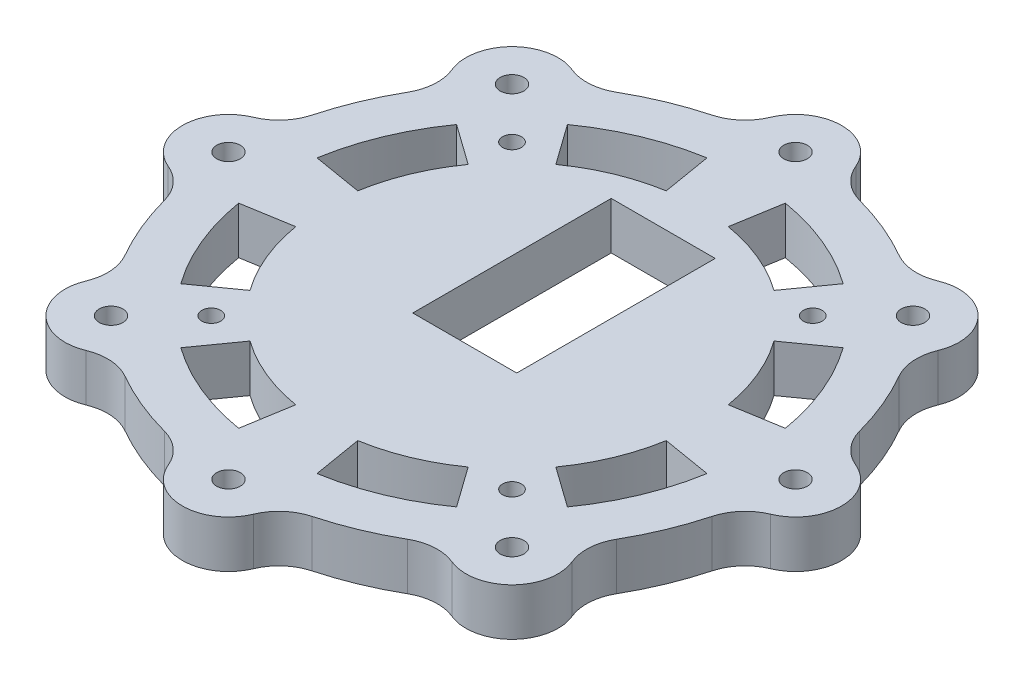
from build123d import *

# Parameters (mm, degrees)
CROQUIS1_W              = 22
CROQUIS1_H              = 42
CROQUIS1_R              = 2.5
CROQUIS1_R_2            = 2
SALIENTE_EXTRUIR1_DEPTH = 10
REDONDEO1_R             = 10
CROQUIS2_R              = 5
CORTAR_EXTRUIR1_DEPTH   = 5


with BuildPart() as part:
    # Croquis1 → Saliente-Extruir1 (new body)
    with BuildSketch(Plane(origin=(0, 0, 0), x_dir=(1, 0, 0), z_dir=(0, 1, 0))):
        with BuildLine():
            ThreePointArc((-34.99474883, -48.737742606), (-22.961005942, -55.432771951), (-9.717764093, -59.2078125))
            ThreePointArc((-9.717764093, -59.2078125), (0, -69.75), (9.717764093, -59.2078125))
            ThreePointArc((9.717764093, -59.2078125), (22.961005942, -55.432771951), (34.99474883, -48.737742606))
            ThreePointArc((34.99474883, -48.737742606), (49.320697988, -49.320697988), (48.737742606, -34.99474883))
            ThreePointArc((48.737742606, -34.99474883), (55.432771951, -22.961005942), (59.2078125, -9.717764093))
            ThreePointArc((59.2078125, -9.717764093), (69.75, 0), (59.2078125, 9.717764093))
            ThreePointArc((59.2078125, 9.717764093), (55.432771951, 22.961005942), (48.737742606, 34.99474883))
            ThreePointArc((48.737742606, 34.99474883), (49.320697988, 49.320697988), (34.99474883, 48.737742606))
            ThreePointArc((34.99474883, 48.737742606), (22.961005942, 55.432771951), (9.717764093, 59.2078125))
            ThreePointArc((9.717764093, 59.2078125), (0, 69.75), (-9.717764093, 59.2078125))
            ThreePointArc((-9.717764093, 59.2078125), (-22.961005942, 55.432771951), (-34.99474883, 48.737742606))
            ThreePointArc((-34.99474883, 48.737742606), (-49.320697988, 49.320697988), (-48.737742606, 34.99474883))
            ThreePointArc((-48.737742606, 34.99474883), (-55.432771951, 22.961005942), (-59.2078125, 9.717764093))
            ThreePointArc((-59.2078125, 9.717764093), (-69.75, 0), (-59.2078125, -9.717764093))
            ThreePointArc((-59.2078125, -9.717764093), (-55.432771951, -22.961005942), (-48.737742606, -34.99474883))
            ThreePointArc((-48.737742606, -34.99474883), (-49.320697988, -49.320697988), (-34.99474883, -48.737742606))
        make_face()
        with Locations((0, 11)):
            Rectangle(CROQUIS1_W, CROQUIS1_H, mode=Mode.SUBTRACT)
        with BuildLine():
            Line((6.560642333, 39.204852661), (8.293642194, 49.560851477))
            ThreePointArc((8.293642194, 49.560851477), (19.229842476, 46.424946509), (29.180323524, 40.909304797))
            Line((29.180323524, 40.909304797), (23.08294249, 32.361091855))
            ThreePointArc((23.08294249, 32.361091855), (15.211666437, 36.724211417), (6.560642333, 39.204852661))
        make_face(mode=Mode.SUBTRACT)
        with BuildLine():
            Line((-8.293642194, 49.560851477), (-6.560642333, 39.204852661))
            ThreePointArc((-6.560642333, 39.204852661), (-15.211666437, 36.724211417), (-23.08294249, 32.361091855))
            Line((-23.08294249, 32.361091855), (-29.180323524, 40.909304797))
            ThreePointArc((-29.180323524, 40.909304797), (-19.229842476, 46.424946509), (-8.293642194, 49.560851477))
        make_face(mode=Mode.SUBTRACT)
        with BuildLine():
            Line((-40.909304797, 29.180323524), (-32.361091855, 23.08294249))
            ThreePointArc((-32.361091855, 23.08294249), (-36.724211417, 15.211666437), (-39.204852661, 6.560642333))
            Line((-39.204852661, 6.560642333), (-49.560851477, 8.293642194))
            ThreePointArc((-49.560851477, 8.293642194), (-46.424946509, 19.229842476), (-40.909304797, 29.180323524))
        make_face(mode=Mode.SUBTRACT)
        with Locations(Location((-42.426406871, -42.426406871, 0), (0, 0, 270))):
            Circle(CROQUIS1_R, mode=Mode.SUBTRACT)
        with Locations(Location((-42.426406871, 42.426406871, 0), (0, 0, 270))):
            Circle(CROQUIS1_R, mode=Mode.SUBTRACT)
        with Locations(Location((-60, 0, 0), (0, 0, 270))):
            Circle(CROQUIS1_R, mode=Mode.SUBTRACT)
        with Locations(Location((0, -60, 0), (0, 0, 270))):
            Circle(CROQUIS1_R, mode=Mode.SUBTRACT)
        with Locations(Location((42.426406871, -42.426406871, 0), (0, 0, 270))):
            Circle(CROQUIS1_R, mode=Mode.SUBTRACT)
        with Locations(Location((60, 0, 0), (0, 0, 270))):
            Circle(CROQUIS1_R, mode=Mode.SUBTRACT)
        with Locations(Location((42.426406871, 42.426406871, 0), (0, 0, 270))):
            Circle(CROQUIS1_R, mode=Mode.SUBTRACT)
        with Locations(Location((0, 60, 0), (0, 0, 270))):
            Circle(CROQUIS1_R, mode=Mode.SUBTRACT)
        with BuildLine():
            Line((-49.560851477, -8.293642194), (-39.204852661, -6.560642333))
            ThreePointArc((-39.204852661, -6.560642333), (-36.724211417, -15.211666437), (-32.361091855, -23.08294249))
            Line((-32.361091855, -23.08294249), (-40.909304797, -29.180323524))
            ThreePointArc((-40.909304797, -29.180323524), (-46.424946509, -19.229842476), (-49.560851477, -8.293642194))
        make_face(mode=Mode.SUBTRACT)
        with BuildLine():
            Line((-29.180323524, -40.909304797), (-23.08294249, -32.361091855))
            ThreePointArc((-23.08294249, -32.361091855), (-15.211666437, -36.724211417), (-6.560642333, -39.204852661))
            Line((-6.560642333, -39.204852661), (-8.293642194, -49.560851477))
            ThreePointArc((-8.293642194, -49.560851477), (-19.229842476, -46.424946509), (-29.180323524, -40.909304797))
        make_face(mode=Mode.SUBTRACT)
        with BuildLine():
            Line((8.293642194, -49.560851477), (6.560642333, -39.204852661))
            ThreePointArc((6.560642333, -39.204852661), (15.211666437, -36.724211417), (23.08294249, -32.361091855))
            Line((23.08294249, -32.361091855), (29.180323524, -40.909304797))
            ThreePointArc((29.180323524, -40.909304797), (19.229842476, -46.424946509), (8.293642194, -49.560851477))
        make_face(mode=Mode.SUBTRACT)
        with BuildLine():
            Line((40.909304797, -29.180323524), (32.361091855, -23.08294249))
            ThreePointArc((32.361091855, -23.08294249), (36.724211417, -15.211666437), (39.204852661, -6.560642333))
            Line((39.204852661, -6.560642333), (49.560851477, -8.293642194))
            ThreePointArc((49.560851477, -8.293642194), (46.424946509, -19.229842476), (40.909304797, -29.180323524))
        make_face(mode=Mode.SUBTRACT)
        with BuildLine():
            Line((49.560851477, 8.293642194), (39.204852661, 6.560642333))
            ThreePointArc((39.204852661, 6.560642333), (36.724211417, 15.211666437), (32.361091855, 23.08294249))
            Line((32.361091855, 23.08294249), (40.909304797, 29.180323524))
            ThreePointArc((40.909304797, 29.180323524), (46.424946509, 19.229842476), (49.560851477, 8.293642194))
        make_face(mode=Mode.SUBTRACT)
        with Locations(Location((31.819805153, 31.819805153, 0), (0, 0, 270))):
            Circle(CROQUIS1_R_2, mode=Mode.SUBTRACT)
        with Locations(Location((31.819805153, -31.819805153, 0), (0, 0, 270))):
            Circle(CROQUIS1_R_2, mode=Mode.SUBTRACT)
        with Locations(Location((-31.819805153, -31.819805153, 0), (0, 0, 270))):
            Circle(CROQUIS1_R_2, mode=Mode.SUBTRACT)
        with Locations(Location((-31.819805153, 31.819805153, 0), (0, 0, 270))):
            Circle(CROQUIS1_R_2, mode=Mode.SUBTRACT)
    extrude(amount=SALIENTE_EXTRUIR1_DEPTH)

    # Redondeo1
    redondeo1_edges = [part.edges().sort_by_distance(p)[0] for p in [
        (-59.2078125, 5, -9.717764093),
        (-48.737742606, 5, -34.99474883),
        (-34.99474883, 5, -48.737742606),
        (-9.717764093, 5, -59.2078125),
        (9.717764093, 5, -59.2078125),
        (34.99474883, 5, -48.737742606),
        (48.737742606, 5, -34.99474883),
        (59.2078125, 5, -9.717764093),
        (59.2078125, 5, 9.717764093),
        (48.737742606, 5, 34.99474883),
        (34.99474883, 5, 48.737742606),
        (9.717764093, 5, 59.2078125),
        (-9.717764093, 5, 59.2078125),
        (-34.99474883, 5, 48.737742606),
        (-48.737742606, 5, 34.99474883),
        (-59.2078125, 5, 9.717764093),
    ]]
    fillet(redondeo1_edges, radius=REDONDEO1_R)

    # Croquis2 → Cortar-Extruir1 (cut)
    with BuildSketch(Plane.XZ):
        with Locations(Location((31.819805153, 31.819805153, 0), (0, 0, 270))):
            Circle(CROQUIS2_R)
        with Locations(Location((31.819805153, -31.819805153, 0), (0, 0, 270))):
            Circle(CROQUIS2_R)
        with Locations(Location((-31.819805153, -31.819805153, 0), (0, 0, 270))):
            Circle(CROQUIS2_R)
        with Locations(Location((-31.819805153, 31.819805153, 0), (0, 0, 270))):
            Circle(CROQUIS2_R)
    extrude(amount=-CORTAR_EXTRUIR1_DEPTH, mode=Mode.SUBTRACT)


solid = part.part
